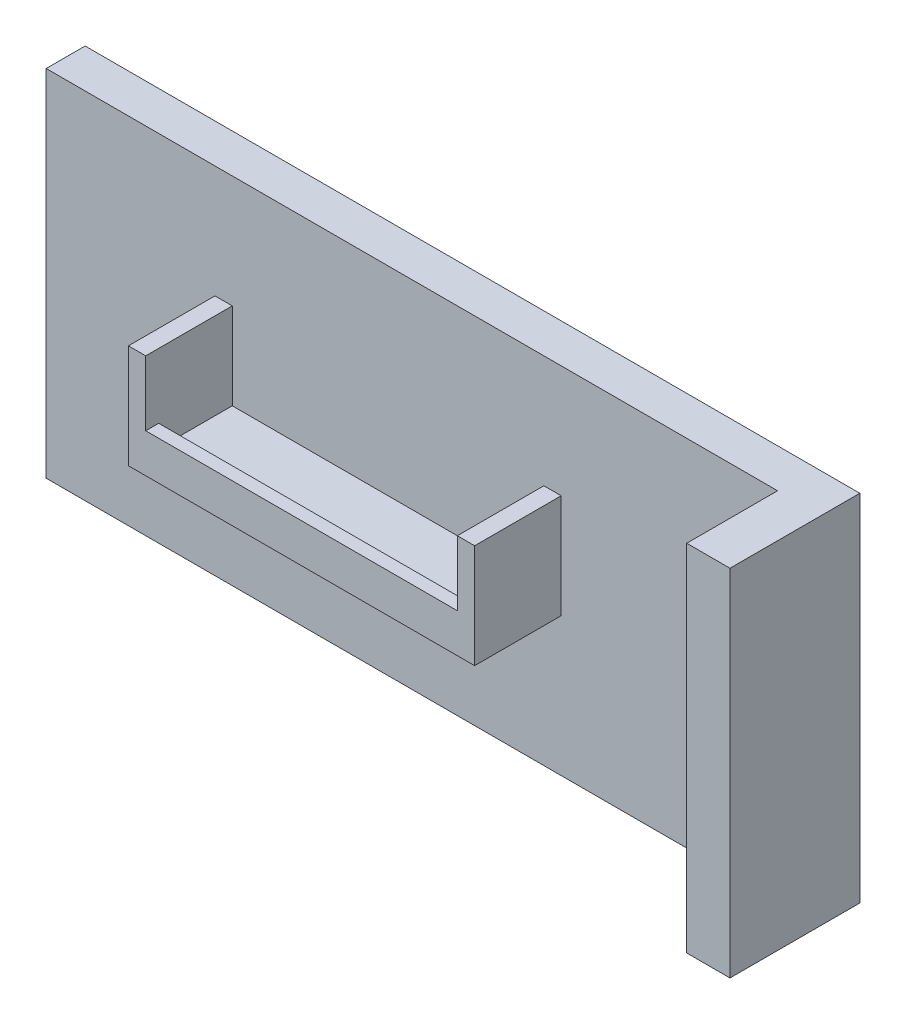
from build123d import *

# Parameters (mm, degrees)
ESQUISSE1_W        = 169
ESQUISSE1_H        = 82
BOSS_EXTRU_1_DEPTH = 9
ESQUISSE2_W        = 10
ESQUISSE2_H        = 30
BOSS_EXTRU_2_DEPTH = 82
ESQUISSE3_W        = 80
ESQUISSE3_H        = 4
BOSS_EXTRU_4_DEPTH = 20
ESQUISSE4_W        = 4
ESQUISSE4_H        = 20
BOSS_EXTRU_5_DEPTH = 20
ESQUISSE5_W        = 4
ESQUISSE5_H        = 20
BOSS_EXTRU_6_DEPTH = 20
ESQUISSE6_W        = 72
ESQUISSE6_H        = 3
BOSS_EXTRU_7_DEPTH = 5


with BuildPart() as part:
    # Esquisse1 → Boss.-Extru.1 (new body)
    with BuildSketch(Plane.XY):
        with Locations((-84.5, 41)):
            Rectangle(ESQUISSE1_W, ESQUISSE1_H)
    extrude(amount=BOSS_EXTRU_1_DEPTH)

    # Esquisse2 → Boss.-Extru.2 (add)
    with BuildSketch(Plane(origin=(0, 82, 0), x_dir=(1, 0, 0), z_dir=(0, 1, 0))):
        with Locations((5, -15)):
            Rectangle(ESQUISSE2_W, ESQUISSE2_H)
    extrude(amount=-BOSS_EXTRU_2_DEPTH)

    # Esquisse3 → Boss.-Extru.4 (add)
    with BuildSketch(Plane.XY.offset(9)):
        with Locations((-90, 34)):
            Rectangle(ESQUISSE3_W, ESQUISSE3_H)
    extrude(amount=BOSS_EXTRU_4_DEPTH)

    # Esquisse4 → Boss.-Extru.5 (add)
    with BuildSketch(Plane(origin=(0, 36, 0), x_dir=(1, 0, 0), z_dir=(0, 1, 0))):
        with Locations((-52, -19)):
            Rectangle(ESQUISSE4_W, ESQUISSE4_H)
    extrude(amount=BOSS_EXTRU_5_DEPTH)

    # Esquisse5 → Boss.-Extru.6 (add)
    with BuildSketch(Plane(origin=(0, 36, 0), x_dir=(1, 0, 0), z_dir=(0, 1, 0))):
        with Locations((-128, -19)):
            Rectangle(ESQUISSE5_W, ESQUISSE5_H)
    extrude(amount=BOSS_EXTRU_6_DEPTH)

    # Esquisse6 → Boss.-Extru.7 (add)
    with BuildSketch(Plane(origin=(0, 36, 0), x_dir=(1, 0, 0), z_dir=(0, 1, 0))):
        with Locations((-90, -27.5)):
            Rectangle(ESQUISSE6_W, ESQUISSE6_H)
    extrude(amount=BOSS_EXTRU_7_DEPTH)


solid = part.part
